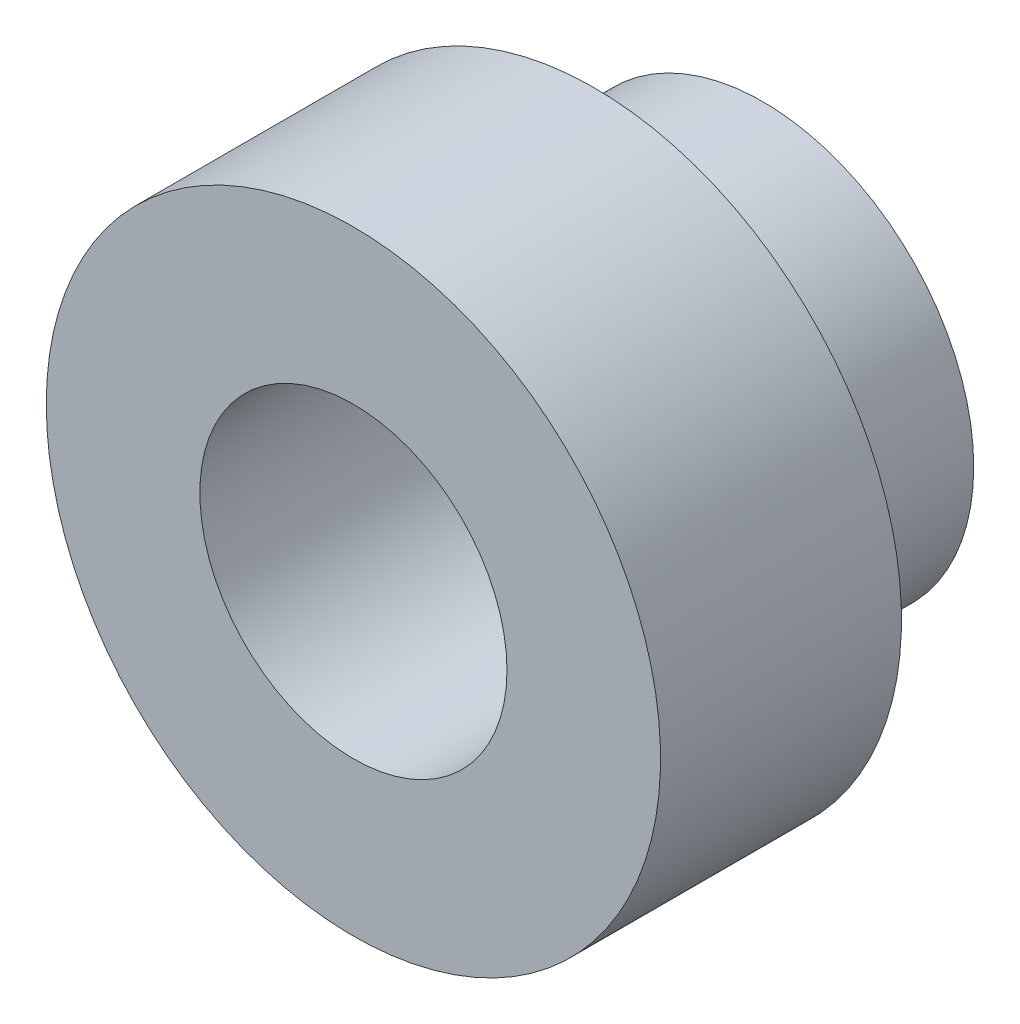
from build123d import *

# Parameters (mm, degrees)
HOLEWZD1_D = 2.55


with BuildPart() as part:
    # Sketch1 → Revolve1 (revolve)
    with BuildSketch(Plane.XZ, mode=Mode.PRIVATE) as revolve1_sk:
        Polygon((2.55, 3.4), (0, 3.4), (0, 0), (1.75, 0), (1.75, 1.4), (2.55, 1.4), align=None)
    revolve(revolve1_sk.sketch.rotate(Axis((0, 0, 2), (0, 0, -1)), 180), axis=Axis((0, 0, 2), (0, 0, -1)))

    # HoleWzd1 (through all)
    with Locations(Plane.XY.offset(3.4)):
        with Locations((0, 0)):
            Hole(HOLEWZD1_D / 2)


solid = part.part
